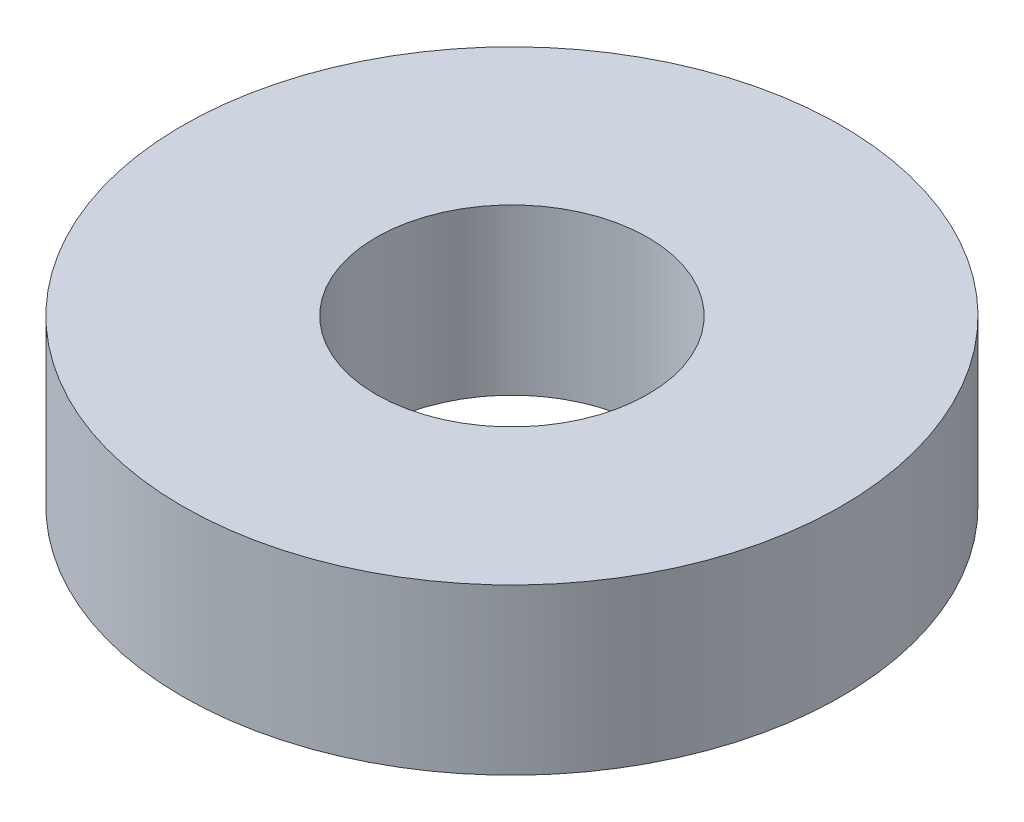
from build123d import *

# Parameters (mm, degrees)
SKETCH2_R           = 4
SKETCH2_R_2         = 1.65
BOSS_EXTRUDE1_DEPTH = 2


with BuildPart() as part:
    # Sketch2 → Boss-Extrude1 (new body)
    with BuildSketch(Plane(origin=(0, 0, 0), x_dir=(1, 0, 0), z_dir=(0, 1, 0))):
        with Locations(Location((0, 0, 0), (0, 0, 270))):
            Circle(SKETCH2_R)
        with Locations(Location((0, 0, 0), (0, 0, 270))):
            Circle(SKETCH2_R_2, mode=Mode.SUBTRACT)
    extrude(amount=BOSS_EXTRUDE1_DEPTH)


solid = part.part
